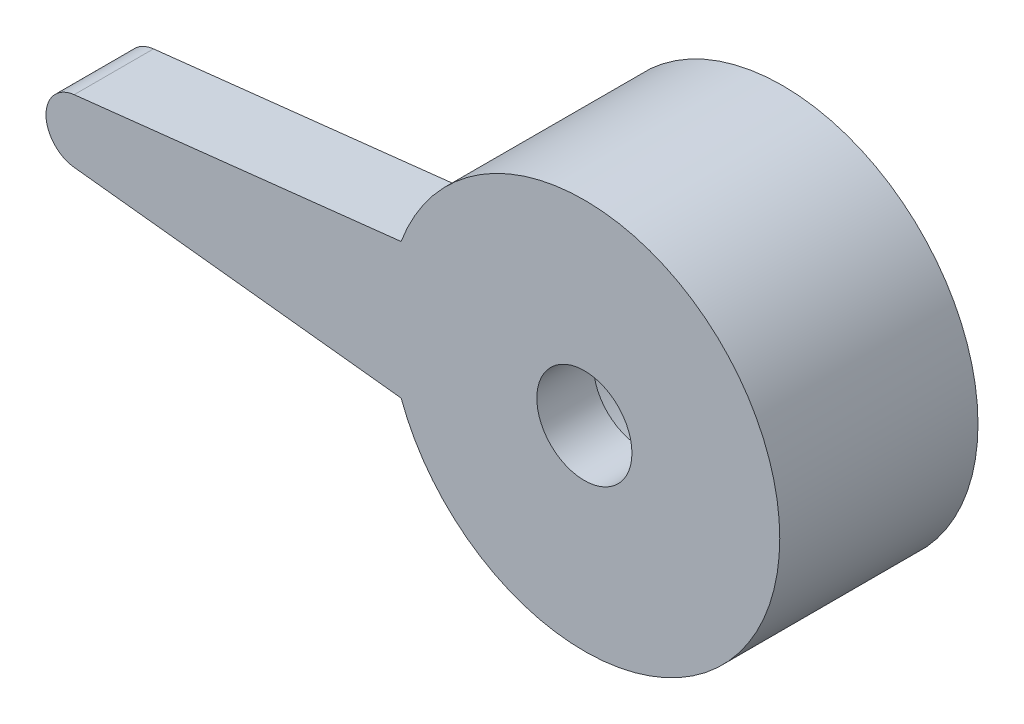
from build123d import *

# Parameters (mm, degrees)
SKETCH7_R               = 3.45
MAIN_BODY_DEPTH         = 3.5
MATE_HOLE_REACH         = 9.005
MATE_START              = -1
SKETCH9_R               = 2.45
CUT_EXTRUDE2_DEPTH      = 7.004581584
CUT_EXTRUDE2_DEPTH_BACK = 7.004581584
SKETCH10_R              = 0.84
BOSS_EXTRUDE2_DEPTH     = 1.4


with BuildPart() as part:
    # Sketch7 → main body (new body)
    with BuildSketch(Plane.XY):
        Circle(SKETCH7_R)
    extrude(amount=-MAIN_BODY_DEPTH)

    # Sketch9 → mate hole (cut, up to next)
    with BuildSketch(Plane.XY.offset(MATE_START), mode=Mode.PRIVATE) as mate_hole_sk1:
        Circle(SKETCH9_R)
    mate_hole_tool1 = extrude(mate_hole_sk1.sketch, amount=-MATE_HOLE_REACH, mode=Mode.PRIVATE) & part.part
    add(mate_hole_tool1.solids().sort_by_distance((0, 0, -1))[0], mode=Mode.SUBTRACT)

    # Sketch10 → Cut-Extrude2 (cut, two sides: drawn at the far end of the back side and taken through both)
    with BuildSketch(Plane.XY.offset(-CUT_EXTRUDE2_DEPTH_BACK)):
        Circle(SKETCH10_R)
    extrude(amount=CUT_EXTRUDE2_DEPTH + CUT_EXTRUDE2_DEPTH_BACK, mode=Mode.SUBTRACT)

    # Sketch11 → Boss-Extrude2 (add)
    with BuildSketch(Plane.XY):
        with BuildLine():
            Line((-3.235641734, 1.197130973), (-9.007776393, 0.556197651))
            ThreePointArc((-9.007776393, 0.556197651), (-9.505632664, 0), (-9.007776393, -0.556197651))
            Line((-9.007776393, -0.556197651), (-3.235641734, -1.197130973))
            ThreePointArc((-3.235641734, -1.197130973), (-3.45, 0), (-3.235641734, 1.197130973))
        make_face()
    extrude(amount=-BOSS_EXTRUDE2_DEPTH)


solid = part.part
